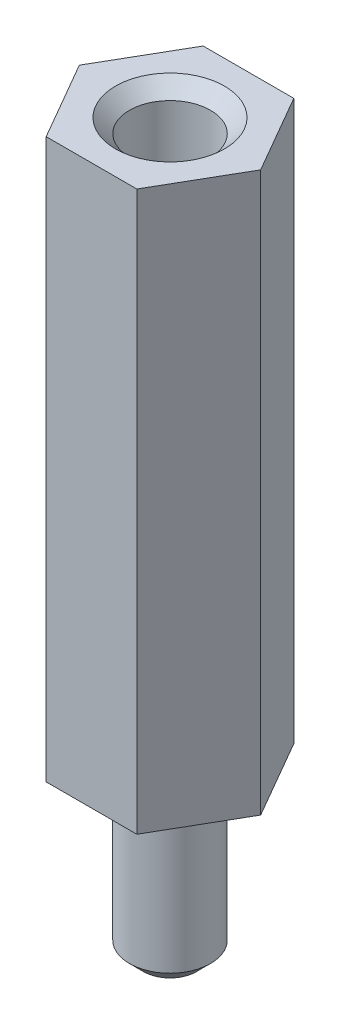
from build123d import *

# Parameters (mm, degrees)
BOSS_EXTRUDE1_DEPTH = 20
SKETCH2_R           = 1.45
BOSS_EXTRUDE2_DEPTH = 6
SKETCH3_R           = 1.45
CUT_EXTRUDE1_DEPTH  = 5
CHAMFER1_SIZE       = 0.5


with BuildPart() as part:
    # Sketch1 → Boss-Extrude1 (new body)
    with BuildSketch(Plane(origin=(0, 0, 0), x_dir=(1, 0, 0), z_dir=(0, 1, 0))):
        Polygon((3.244708513, 0), (1.622354256, 2.81), (-1.622354256, 2.81), (-3.244708513, 0), (-1.622354256, -2.81), (1.622354256, -2.81), align=None)
    extrude(amount=BOSS_EXTRUDE1_DEPTH)

    # Sketch2 → Boss-Extrude2 (add)
    with BuildSketch(Plane.XZ):
        with Locations(Location((0, 0, 0), (0, 0, 270))):
            Circle(SKETCH2_R)
    extrude(amount=BOSS_EXTRUDE2_DEPTH)

    # Sketch3 → Cut-Extrude1 (cut)
    with BuildSketch(Plane(origin=(0, 20, 0), x_dir=(1, 0, 0), z_dir=(0, 1, 0))):
        with Locations(Location((0, 0, 0), (0, 0, 90))):
            Circle(SKETCH3_R)
    extrude(amount=-CUT_EXTRUDE1_DEPTH, mode=Mode.SUBTRACT)

    # Chamfer1
    chamfer1_edges = [part.edges().sort_by_distance(p)[0] for p in [
        (0, -6, 1.45),
        (0, 20, 1.45),
    ]]
    chamfer(chamfer1_edges, length=CHAMFER1_SIZE)


solid = part.part
